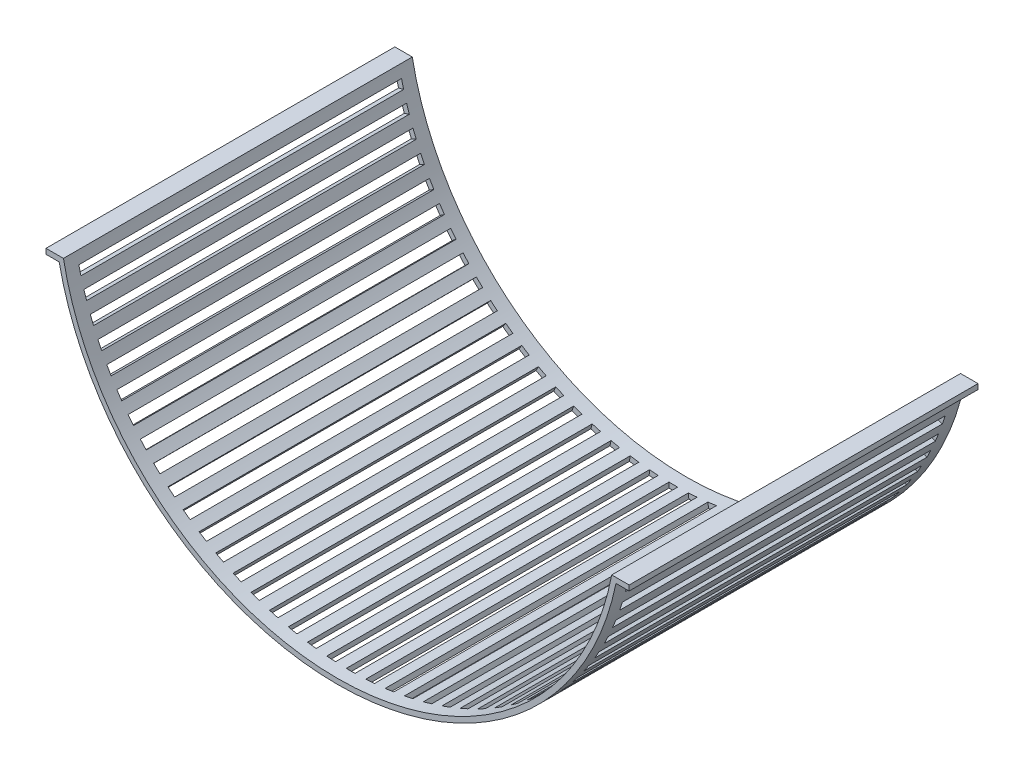
from build123d import *

# Parameters (mm, degrees)
BOSS_EXTRUDE1_DEPTH = 100
SKETCH3_W           = 5
SKETCH3_H           = 185
CUT_EXTRUDE1_DEPTH  = 200
CIRPATTERN1_COUNT   = 90


with BuildPart() as part:
    # Sketch2 → Boss-Extrude1 (new, symmetric)
    with BuildSketch(Plane.XY):
        with BuildLine():
            Line((-167.162336455, 0), (-157.162336455, 0))
            ThreePointArc((-157.162336455, 0), (0, -130), (157.162336455, 0))
            Line((157.162336455, 0), (167.162336455, 0))
            Line((167.162336455, 0), (167.162336455, -3))
            Line((167.162336455, -3), (159.624559514, -3))
            ThreePointArc((159.624559514, -3), (0, -133), (-159.624559514, -3))
            Line((-159.624559514, -3), (-167.162336455, -3))
            Line((-167.162336455, -3), (-167.162336455, 0))
        make_face()
    extrude(amount=BOSS_EXTRUDE1_DEPTH, both=True)

    # Sketch3 → Cut-Extrude1 (cut)
    with BuildSketch(Plane(origin=(0, 0, 0), x_dir=(1, 0, 0), z_dir=(0, 1, 0))):
        Rectangle(SKETCH3_W, SKETCH3_H)
    cut_extrude1 = extrude(amount=-CUT_EXTRUDE1_DEPTH, mode=Mode.SUBTRACT)

    # CirPattern1: Cut-Extrude1 ×90 about axis, 2 skipped
    cirpattern1_axis = Axis((0, 30, 0), (0, 0, 1))
    add([cut_extrude1.rotate(cirpattern1_axis, i * 360 / CIRPATTERN1_COUNT) for i in range(1, CIRPATTERN1_COUNT) if i not in (20, 70)], mode=Mode.SUBTRACT)


solid = part.part
